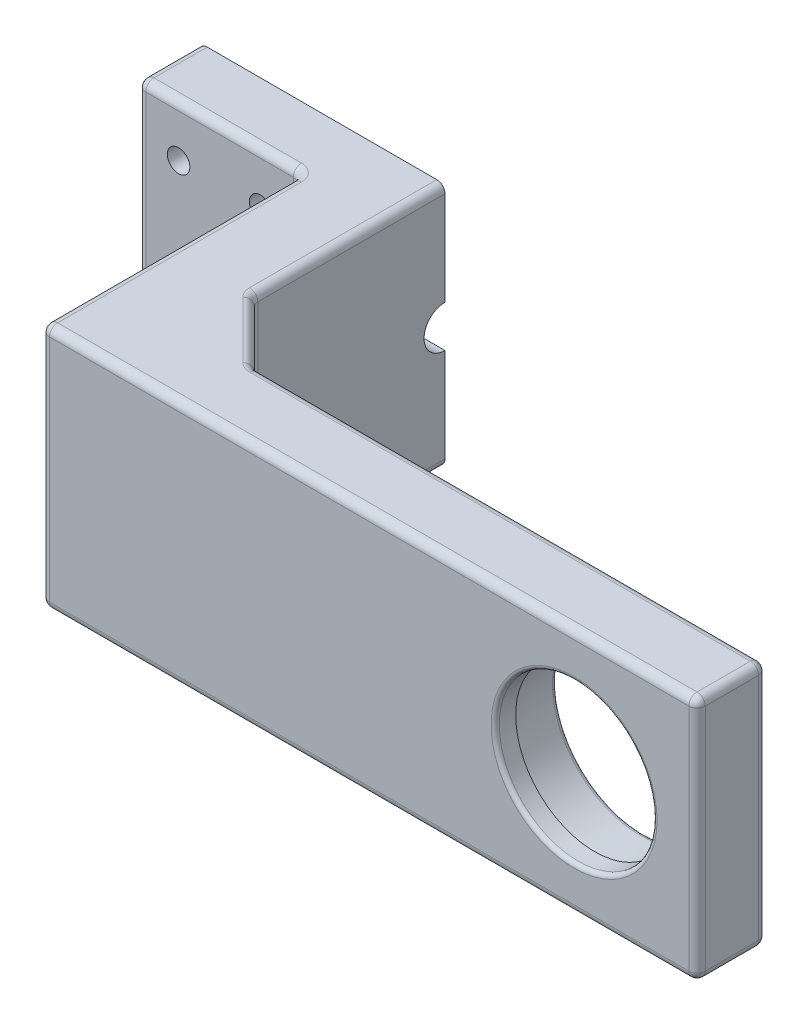
from build123d import *

# Parameters (mm, degrees)
SKETCH1_W               = 60
SKETCH1_H               = 60
SKETCH1_R               = 21.25
BOSS_EXTRUDE1_DEPTH     = 12
SKETCH2_W               = 60
SKETCH2_H               = 60
SKETCH2_R               = 19.25
BOSS_EXTRUDE2_DEPTH     = 5
BOSS_EXTRUDE3_DEPTH     = 30
SKETCH4_W               = 15
SKETCH4_H               = 60
BOSS_EXTRUDE4_DEPTH     = 40
CUT_EXTRUDE1_DEPTH      = 212.381763641
CUT_EXTRUDE1_DEPTH_BACK = 212.381763641
SKETCH5_R               = 5.1
SKETCH6_R               = 2.75
CUT_EXTRUDE2_DEPTH      = 184.935450634
CHAMFER1_SIZE           = 15
FILLET1_R               = 1
FILLET2_R               = 1
FILLET3_R               = 2


with BuildPart() as part:
    # Sketch1 → Boss-Extrude1 (new body)
    with BuildSketch(Plane.XY):
        Rectangle(SKETCH1_W, SKETCH1_H)
        Circle(SKETCH1_R, mode=Mode.SUBTRACT)
    extrude(amount=BOSS_EXTRUDE1_DEPTH)

    # Sketch2 → Boss-Extrude2 (add)
    with BuildSketch(Plane.XY.offset(12)):
        Rectangle(SKETCH2_W, SKETCH2_H)
        Circle(SKETCH2_R, mode=Mode.SUBTRACT)
    extrude(amount=BOSS_EXTRUDE2_DEPTH)

    # Sketch3 → Boss-Extrude3 (add, symmetric)
    with BuildSketch(Plane(origin=(0, 0, 0), x_dir=(1, 0, 0), z_dir=(0, 1, 0))):
        Polygon((-30, 0), (-110, 0), (-110, 61.5), (-130, 61.5), (-130, -17), (-30, -17), align=None)
    extrude(amount=BOSS_EXTRUDE3_DEPTH, both=True)

    # Sketch4 → Boss-Extrude4 (add)
    with BuildSketch(Plane.ZY.offset(130)):
        with Locations((-54, 0)):
            Rectangle(SKETCH4_W, SKETCH4_H)
    extrude(amount=BOSS_EXTRUDE4_DEPTH)

    # Sketch5 → Cut-Extrude1 (cut, two sides: drawn at the far end of the back side and taken through both)
    with BuildSketch(Plane.ZY.offset(170).offset(-CUT_EXTRUDE1_DEPTH_BACK)):
        with Locations((-61.5, 0)):
            Circle(SKETCH5_R)
    extrude(amount=CUT_EXTRUDE1_DEPTH + CUT_EXTRUDE1_DEPTH_BACK, mode=Mode.SUBTRACT)

    # Sketch6 → Cut-Extrude2 (cut, through all)
    with BuildSketch(Plane.XY.offset(-46.5)):
        with Locations((-140, 17.5)):
            Circle(SKETCH6_R)
        with Locations(Location((-140, -17.5, 0), (0, 0, 180))):
            Circle(SKETCH6_R)
        with Locations((-160, -17.5)):
            Circle(SKETCH6_R)
        with Locations(Location((-160, 17.5, 0), (0, 0, 180))):
            Circle(SKETCH6_R)
    extrude(amount=-CUT_EXTRUDE2_DEPTH, mode=Mode.SUBTRACT)

    # Chamfer1
    chamfer1_edges = [part.edges().sort_by_distance(p)[0] for p in [
        (-110, 0, 0),
    ]]
    chamfer(chamfer1_edges, length=CHAMFER1_SIZE)

    # Fillet1
    fillet1_edges = [part.edges().sort_by_distance(p)[0] for p in [
        (-21.25, 0, 0),
    ]]
    fillet(fillet1_edges, radius=FILLET1_R)

    # Fillet2
    fillet2_edges = [part.edges().sort_by_distance(p)[0] for p in [
        (-19.25, 0, 17),
    ]]
    fillet(fillet2_edges, radius=FILLET2_R)

    # Fillet3
    fillet3_edges = [part.edges().sort_by_distance(p)[0] for p in [
        (-50, 30, 17),
        (-50, -30, 17),
        (30, 0, 17),
        (-130, 0, 17),
        (-130, -30, -14.75),
        (-130, 30, -14.75),
        (-130, 0, -46.5),
        (-150, -30, -46.5),
        (-150, 30, -46.5),
        (-170, -30, -54),
        (-170, 0, -46.5),
        (-170, 30, -54),
        (-32.5, 30, 0),
        (30, 0, 0),
        (30, -30, 8.5),
        (30, 30, 8.5),
        (-110, 30, -38.25),
        (-110, -30, -38.25),
        (-110, 0, -15),
        (-32.5, -30, 0),
        (-95, 0, 0),
        (-102.5, -30, -7.5),
        (-102.5, 30, -7.5),
    ]]
    fillet(fillet3_edges, radius=FILLET3_R)


solid = part.part
